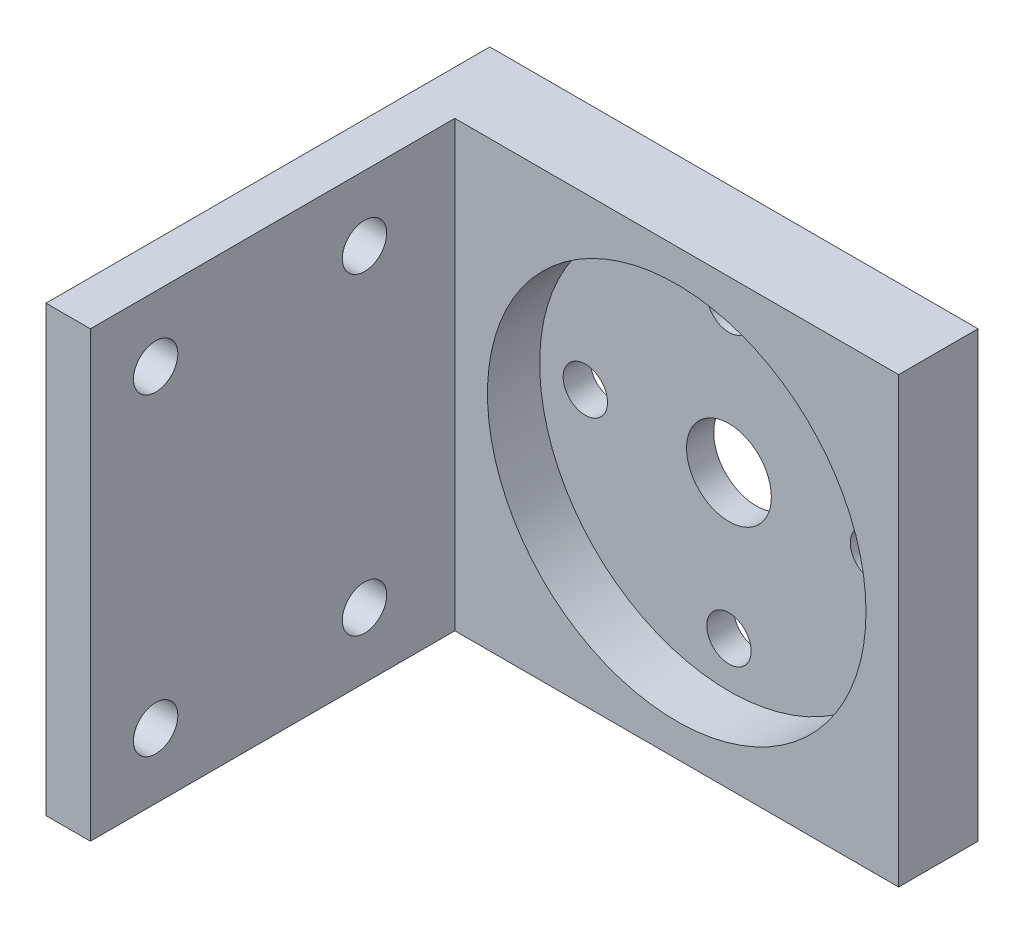
from build123d import *

# Parameters (mm, degrees)
SKETCH1_W            = 34
SKETCH1_H            = 34
BOSS_EXTRUDE1_DEPTH  = 6.08
SKETCH2_W            = 34
SKETCH2_H            = 34
BOSS_EXTRUDE2_DEPTH  = 3.4
HOLE1_D              = 3.4
SKETCH5_R            = 14.5
CUT_EXTRUDE1_DEPTH   = 4
M3_CLEARANCE_HOLE1_D = 3.4
HOLE2_D              = 6.5


with BuildPart() as part:
    # Sketch1 → Boss-Extrude1 (new body)
    with BuildSketch(Plane(origin=(0, 0, 0), x_dir=(0, 1, 0), z_dir=(0, 0, 1))):
        with Locations((17, 17)):
            Rectangle(SKETCH1_W, SKETCH1_H)
    extrude(amount=BOSS_EXTRUDE1_DEPTH)

    # Sketch2 → Boss-Extrude2 (add)
    with BuildSketch(Plane(origin=(-34, 0, 0), x_dir=(0, -1, 0), z_dir=(-1, 0, 0))):
        with Locations((-17, 17)):
            Rectangle(SKETCH2_W, SKETCH2_H)
    extrude(amount=BOSS_EXTRUDE2_DEPTH)

    # Hole1 (through all)
    with Locations(Plane.YZ.offset(-34)):
        with Locations((5, 29), (29, 29), (5, 13), (29, 13)):
            Hole(HOLE1_D / 2)

    # Sketch5 → Cut-Extrude1 (cut)
    with BuildSketch(Plane.XY.offset(6.08)):
        with Locations((-17, 17)):
            Circle(SKETCH5_R)
    extrude(amount=-CUT_EXTRUDE1_DEPTH, mode=Mode.SUBTRACT)

    # M3 Clearance Hole1 (through all)
    with Locations(Plane(origin=(0, 0, 2.08), x_dir=(0, -1, 0), z_dir=(0, 0, 1))):
        with Locations((-17, -6), (-6, -17), (-17, -28), (-28, -17)):
            Hole(M3_CLEARANCE_HOLE1_D / 2)

    # Hole2 (through all)
    with Locations(Plane(origin=(0, 0, 2.08), x_dir=(0, -1, 0), z_dir=(0, 0, 1))):
        with Locations((-17, -17)):
            Hole(HOLE2_D / 2)


solid = part.part
